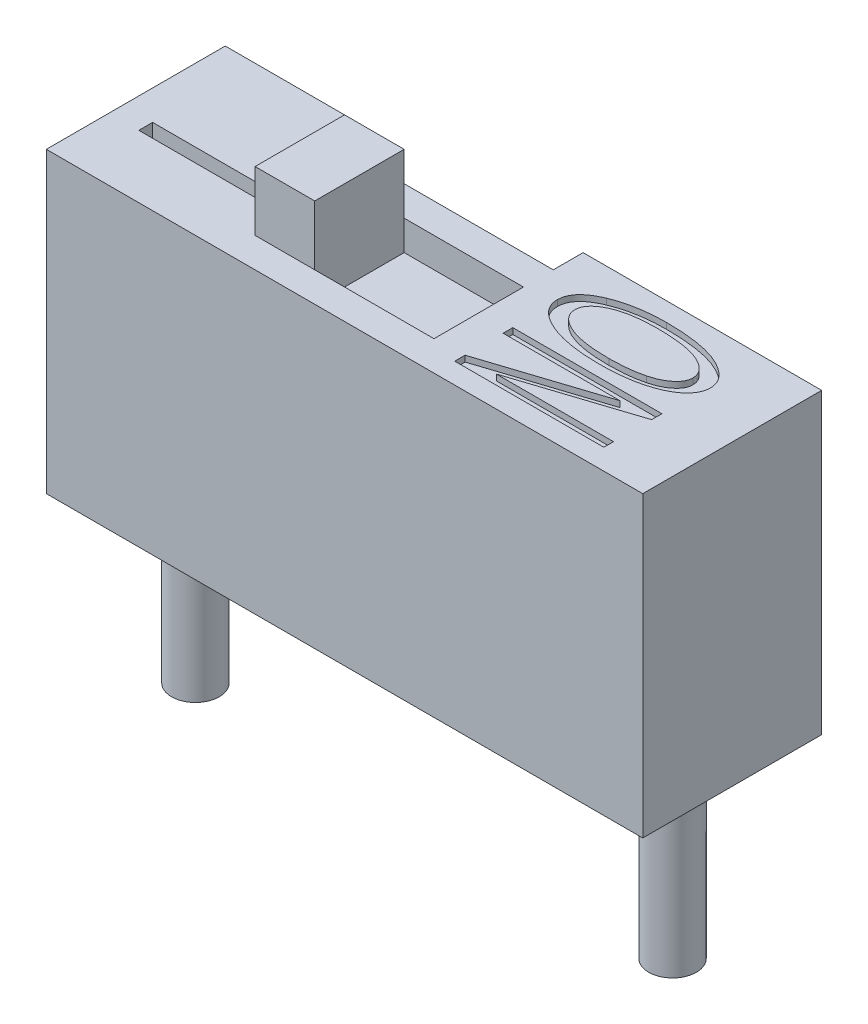
from build123d import *

# Parameters (mm, degrees)
ESBO_O1_W                = 10
ESBO_O1_H                = 3
RESSALTO_EXTRUS_O1_DEPTH = 5
ESBO_O4_W                = 1
ESBO_O4_H                = 1.5
RESSALTO_EXTRUS_O2_DEPTH = 1
ESBO_O8_W                = 2
ESBO_O8_H                = 1.5
CORTE_EXTRUS_O2_DEPTH    = 0.5
CORTE_EXTRUS_O5_DEPTH    = 0.1
CORTE_EXTRUS_O6_DEPTH    = 0.5
ESBO_O11_R               = 0.4
RESSALTO_EXTRUS_O4_DEPTH = 3
ESBO_O19_W               = 3
ESBO_O19_H               = 2
CORTE_EXTRUS_O9_DEPTH    = 0.5
ESBO_O21_W               = 2.995544047
ESBO_O21_H               = 1
CORTE_EXTRUS_O10_DEPTH   = 0.3


with BuildPart() as part:
    # Esboço1 → Ressalto-extrusão1 (new body)
    with BuildSketch(Plane(origin=(0, 0, 0), x_dir=(1, 0, 0), z_dir=(0, 1, 0))):
        with Locations((5, 1.5)):
            Rectangle(ESBO_O1_W, ESBO_O1_H)
    extrude(amount=RESSALTO_EXTRUS_O1_DEPTH)

    # Esboço4 → Ressalto-extrusão2 (add)
    with BuildSketch(Plane(origin=(0, 5, 0), x_dir=(1, 0, 0), z_dir=(0, 1, 0))):
        with Locations((3.5, 1.25)):
            Rectangle(ESBO_O4_W, ESBO_O4_H)
    extrude(amount=RESSALTO_EXTRUS_O2_DEPTH)

    # Esboço8 → Corte-extrusão2 (cut)
    with BuildSketch(Plane(origin=(0, 5, 0), x_dir=(1, 0, 0), z_dir=(0, 1, 0))):
        with Locations((5, 1.25)):
            Rectangle(ESBO_O8_W, ESBO_O8_H)
    extrude(amount=-CORTE_EXTRUS_O2_DEPTH, mode=Mode.SUBTRACT)

    # Esboço9 → Corte-extrusão5 (cut)
    # profile 1 of 2: a face of its own
    with BuildSketch(Plane(origin=(0, 5, 0), x_dir=(1, 0, 0), z_dir=(0, 1, 0))):
        with BuildLine():
            add(Edge.make_bspline(
                [(7.717025162, 2.685064935), (7.768275073, 2.684653139), (7.867968532, 2.683852096), (8.012830606, 2.675522502), (8.148601104, 2.662599241), (8.275087284, 2.644432886), (8.392605867, 2.621489185), (8.500848932, 2.592511147), (8.600323781, 2.558959581), (8.689910066, 2.519182744), (8.770052693, 2.476635016), (8.839594359, 2.430662628), (8.899331263, 2.382896177), (8.947218272, 2.331040045), (8.986118217, 2.27759415), (9.012308422, 2.220411921), (9.029958288, 2.161052106), (9.031626399, 2.120222692), (9.032467532, 2.09963474)],
                knots=[0, 0, 0, 0, 1.57056582, 3.055129997, 4.445450912, 5.749355923, 6.970061349, 8.112815838, 9.181428645, 10.183885427, 11.113725231, 11.958931196, 12.736004884, 13.451083261, 14.116830729, 14.752105534, 15.370757766, 16, 16, 16, 16], degree=3))
            add(Edge.make_bspline(
                [(9.032467532, 2.09963474), (9.031952466, 2.086243406), (9.03092816, 2.059612265), (9.023519116, 2.020284156), (9.011816828, 1.98174038), (8.994996923, 1.944322939), (8.973326429, 1.907779642), (8.946647613, 1.872377676), (8.91588358, 1.837308554), (8.879929464, 1.803879089), (8.84003574, 1.771271209), (8.79508583, 1.741089795), (8.746201299, 1.712010826), (8.693008442, 1.684722634), (8.635338402, 1.659358364), (8.573479622, 1.635698049), (8.507410398, 1.613183974), (8.437075438, 1.593196089), (8.363020356, 1.57481891), (8.285320249, 1.559134103), (8.204039884, 1.546195816), (8.119518678, 1.534740096), (8.031299129, 1.526956469), (7.939792349, 1.520962638), (7.844740014, 1.516511464), (7.78027454, 1.516327433), (7.747463474, 1.516233766)],
                knots=[0, 0, 0, 0, 0.628587138, 1.250061679, 1.873005727, 2.516415511, 3.171480457, 3.863935128, 4.5952753, 5.359255262, 6.166615866, 7.012388062, 7.898965013, 8.83656428, 9.817805068, 10.856001284, 11.945846033, 13.094426735, 14.28852422, 15.528171294, 16.815382826, 18.152972552, 19.532612895, 20.973073027, 22.459381521, 24, 24, 24, 24], degree=3))
            add(Edge.make_bspline(
                [(7.747463474, 1.516233766), (7.702642019, 1.51673791), (7.614970919, 1.517724018), (7.486687775, 1.524909023), (7.364657949, 1.536494006), (7.248954096, 1.552416836), (7.139735974, 1.573715014), (7.036976444, 1.599695769), (6.940209946, 1.629432703), (6.87929448, 1.654605061), (6.849533279, 1.666903409)],
                knots=[0, 0, 0, 0, 1.173580742, 2.295532635, 3.363077746, 4.382515045, 5.352490311, 6.274976113, 7.157212698, 8, 8, 8, 8], degree=3))
            add(Edge.make_bspline(
                [(6.849533279, 1.666903409), (6.819495721, 1.680737693), (6.762099909, 1.707172265), (6.684107261, 1.753561383), (6.617281662, 1.802485084), (6.562765507, 1.855474257), (6.520316361, 1.9119252), (6.489575578, 1.97162645), (6.471096623, 2.035136967), (6.468725659, 2.078717419), (6.467532468, 2.100649351)],
                knots=[0, 0, 0, 0, 1.293359014, 2.471352389, 3.544683947, 4.527349473, 5.435248781, 6.296440752, 7.142681094, 8, 8, 8, 8], degree=3))
            add(Edge.make_bspline(
                [(6.467532468, 2.100649351), (6.468673515, 2.122760058), (6.470934698, 2.166576254), (6.490149361, 2.23047144), (6.521930555, 2.290377771), (6.565195504, 2.347502443), (6.621476513, 2.400294414), (6.689828213, 2.449371296), (6.769790362, 2.49578785), (6.828783463, 2.521791334), (6.859679383, 2.535409903)],
                knots=[0, 0, 0, 0, 0.851796778, 1.68798283, 2.548876701, 3.4571018, 4.440058662, 5.514094689, 6.698079403, 8, 8, 8, 8], degree=3))
            add(Edge.make_bspline(
                [(6.859679383, 2.535409903), (6.889983671, 2.547446904), (6.951310735, 2.571806293), (7.047289586, 2.602023308), (7.147652813, 2.628051521), (7.252801276, 2.648342721), (7.36221225, 2.665485653), (7.476356384, 2.676921818), (7.595195642, 2.68340278), (7.675925466, 2.6845042), (7.717025162, 2.685064935)],
                knots=[0, 0, 0, 0, 0.893133914, 1.807443268, 2.754742093, 3.732427724, 4.740212323, 5.788095056, 6.873915258, 8, 8, 8, 8], degree=3))
        make_face()
        with BuildLine():
            add(Edge.make_bspline(
                [(7.712966721, 2.522727273), (7.676265876, 2.522308225), (7.605018602, 2.52149473), (7.50124071, 2.516066621), (7.403787401, 2.506272361), (7.312351828, 2.493718156), (7.227668706, 2.475551712), (7.149030594, 2.455141256), (7.076719376, 2.430343071), (7.011040089, 2.401515886), (6.952378669, 2.370275717), (6.901011675, 2.337541762), (6.858096688, 2.302123084), (6.822086823, 2.265855819), (6.794084242, 2.227459146), (6.774410061, 2.1871143), (6.762168952, 2.14498675), (6.760550491, 2.116116802), (6.75974026, 2.101663961)],
                knots=[0, 0, 0, 0, 1.558654721, 3.025813207, 4.411400106, 5.717489512, 6.942859823, 8.087338287, 9.166121262, 10.185517822, 11.13009939, 11.986629339, 12.767303909, 13.488465908, 14.152164316, 14.77526212, 15.386873072, 16, 16, 16, 16], degree=3))
            add(Edge.make_bspline(
                [(6.75974026, 2.101663961), (6.760546361, 2.08687607), (6.762147128, 2.057510041), (6.774313031, 2.014588099), (6.794620069, 1.973819375), (6.82312444, 1.935125343), (6.858951297, 1.897980531), (6.902606815, 1.862790076), (6.954424216, 1.830037922), (7.013593655, 1.798559592), (7.080701403, 1.770420052), (7.15507718, 1.745439683), (7.237089191, 1.7250245), (7.326311037, 1.707753487), (7.423058943, 1.694892365), (7.527126513, 1.685211994), (7.638673744, 1.679804459), (7.715497711, 1.678990654), (7.755073052, 1.678571429)],
                knots=[0, 0, 0, 0, 0.604278522, 1.199985849, 1.809349222, 2.458215998, 3.157745631, 3.91497363, 4.745708597, 5.661544455, 6.653291882, 7.718463054, 8.867568289, 10.107387628, 11.433779257, 12.857748944, 14.38129083, 16, 16, 16, 16], degree=3))
            add(Edge.make_bspline(
                [(7.755073052, 1.678571429), (7.806337615, 1.67933264), (7.906298407, 1.680816928), (8.051928946, 1.692847075), (8.189578018, 1.711140794), (8.277380562, 1.731189916), (8.320211039, 1.740969968)],
                knots=[0, 0, 0, 0, 1.079278855, 2.104486288, 3.075359866, 4, 4, 4, 4], degree=3))
            add(Edge.make_bspline(
                [(8.320211039, 1.740969968), (8.350692489, 1.749465777), (8.409390915, 1.765826239), (8.490866203, 1.799714474), (8.563441842, 1.83845794), (8.625079395, 1.883949286), (8.675708543, 1.933016459), (8.713082539, 1.985414753), (8.736039938, 2.041202632), (8.738865882, 2.07965435), (8.74025974, 2.09862013)],
                knots=[0, 0, 0, 0, 1.286425693, 2.477282489, 3.58266256, 4.625773343, 5.584234355, 6.439323877, 7.230217995, 8, 8, 8, 8], degree=3))
            add(Edge.make_bspline(
                [(8.74025974, 2.09862013), (8.739452698, 2.113743816), (8.737850374, 2.143770825), (8.725711477, 2.187701113), (8.705482151, 2.229237127), (8.67758473, 2.268647264), (8.642026485, 2.305993002), (8.598385597, 2.341015015), (8.546814492, 2.373728066), (8.487776446, 2.404835686), (8.420389396, 2.432702421), (8.344485848, 2.456804565), (8.260267259, 2.477516021), (8.167366142, 2.493969498), (8.065977549, 2.507157629), (7.955920014, 2.515874448), (7.837316624, 2.521580425), (7.755418511, 2.522335751), (7.712966721, 2.522727273)],
                knots=[0, 0, 0, 0, 0.600308238, 1.19186952, 1.795812957, 2.42762189, 3.102433314, 3.837918584, 4.644800175, 5.52526194, 6.485928958, 7.537561936, 8.686253011, 9.92885608, 11.283752085, 12.746554137, 14.313580151, 16, 16, 16, 16], degree=3))
        make_face(mode=Mode.SUBTRACT)
    # profile 2 of 2: a face of its own
    with BuildSketch(Plane(origin=(0, 5, 0), x_dir=(1, 0, 0), z_dir=(0, 1, 0))):
        Polygon((6.5, 1.321428571), (9, 1.321428571), (9, 1.148944805), (7.035714286, 0.50974026), (9, 0.50974026), (9, 0.347402597), (6.5, 0.347402597), (6.5, 0.520900974), (8.461241883, 1.159090909), (6.5, 1.159090909), align=None)
    extrude(amount=-CORTE_EXTRUS_O5_DEPTH, mode=Mode.SUBTRACT)

    # Esboço10 → Corte-extrusão6 (cut)
    with BuildSketch(Plane(origin=(0, 5, 0), x_dir=(1, 0, 0), z_dir=(0, 1, 0))):
        Polygon((2.5, 1.504407051), (2.5, 1.051282051), (0.5, 1.051282051), (0.5, 1.282051282), (2.294871795, 1.282051282), (2.294871795, 1.641025641), align=None)
    extrude(amount=-CORTE_EXTRUS_O6_DEPTH, mode=Mode.SUBTRACT)

    # Esboço11 → Ressalto-extrusão4 (add)
    with BuildSketch(Plane.XZ):
        with Locations(Location((1, -1.5, 0), (0, 0, 270))):
            Circle(ESBO_O11_R)
        with Locations(Location((9, -1.5, 0), (0, 0, 270))):
            Circle(ESBO_O11_R)
    extrude(amount=RESSALTO_EXTRUS_O4_DEPTH)

    # Esboço19 → Corte-extrusão9 (cut)
    with BuildSketch(Plane(origin=(0, 0, -3), x_dir=(-1, 0, 0), z_dir=(0, 0, -1))):
        with Locations((-4.5, 4)):
            Rectangle(ESBO_O19_W, ESBO_O19_H)
    extrude(amount=-CORTE_EXTRUS_O9_DEPTH, mode=Mode.SUBTRACT)

    # Esboço21 → Corte-extrusão10 (cut)
    with BuildSketch(Plane(origin=(0, 0, -3), x_dir=(-1, 0, 0), z_dir=(0, 0, -1))):
        with Locations((-4.502227977, 2.5)):
            Rectangle(ESBO_O21_W, ESBO_O21_H)
    extrude(amount=-CORTE_EXTRUS_O10_DEPTH, mode=Mode.SUBTRACT)


solid = part.part
